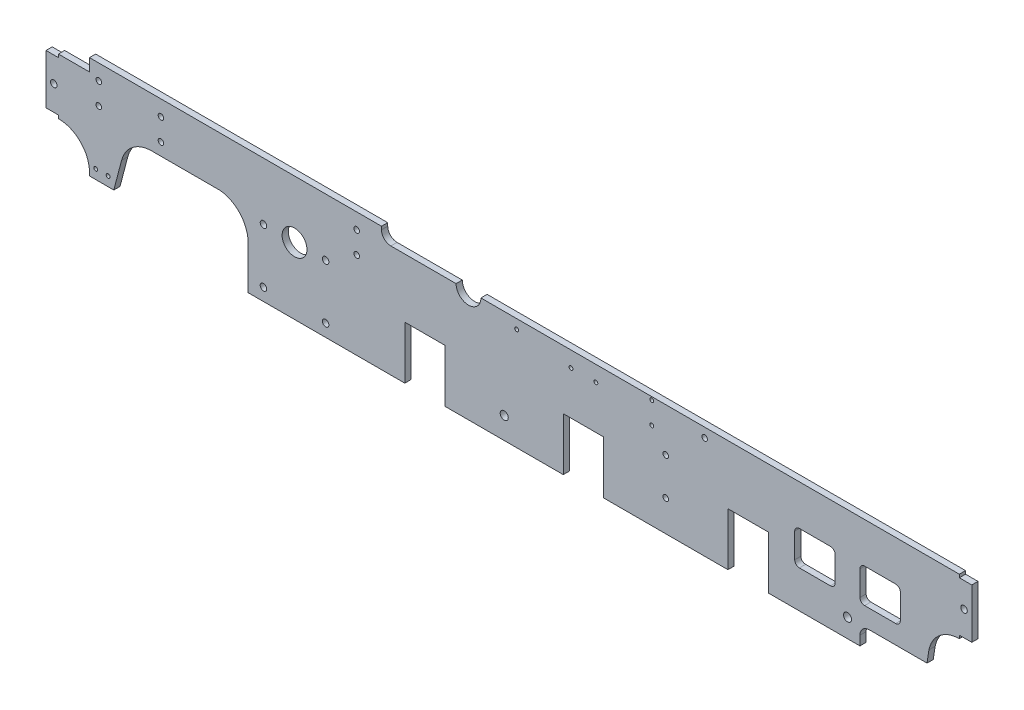
from build123d import *

# Parameters (mm, degrees)
ESQUISSE1_R        = 1.05
ESQUISSE1_R_2      = 1.3
ESQUISSE1_R_3      = 0.625
ESQUISSE1_R_4      = 0.9
ESQUISSE1_R_5      = 4
BOSS_EXTRU_1_DEPTH = 2


with BuildPart() as part:
    # Esquisse1 → Boss.-Extru.1 (new body)
    with BuildSketch(Plane.XY):
        with BuildLine():
            Line((-145, 15), (-149, 15))
            Line((-149, 15), (-149, -1))
            Line((-149, -1), (-145, -1))
            Line((-145, -1), (-145, -2))
            ThreePointArc((-145, -2), (-137.928932188, -4.928932188), (-135, -12))
            Line((-135, -12), (-135, -13))
            Line((-135, -13), (-127.168338795, -13))
            Line((-127.168338795, -13), (-124.67428839, -3.468568753))
            ThreePointArc((-124.67428839, -3.468568753), (-121.110879132, 1.915627343), (-115, 4))
            Line((-115, 4), (-92.916549028, 4))
            ThreePointArc((-92.916549028, 4), (-86.162816659, 0.304952282), (-84, -7.083450972))
            Line((-84, -7.083450972), (-84, -20))
            Line((-84, -20), (-33.5, -20))
            Line((-33.5, -20), (-33.5, -3))
            Line((-33.5, -3), (-20.5, -3))
            Line((-20.5, -3), (-20.5, -20))
            Line((-20.5, -20), (17.5, -20))
            Line((17.5, -20), (17.5, -3))
            Line((17.5, -3), (30.5, -3))
            Line((30.5, -3), (30.5, -20))
            Line((30.5, -20), (70.5, -20))
            Line((70.5, -20), (70.5, -3))
            Line((70.5, -3), (83.5, -3))
            Line((83.5, -3), (83.5, -20))
            Line((83.5, -20), (113, -20))
            Line((113, -20), (113, -17))
            ThreePointArc((113, -17), (113.878679656, -14.878679656), (116, -14))
            Line((116, -14), (134.596227596, -14))
            Line((134.596227596, -14), (135.202041029, -10))
            ThreePointArc((135.202041029, -10), (138.67544468, -4.254033308), (145, -2))
            Line((145, -2), (145, -1))
            Line((145, -1), (149, -1))
            Line((149, -1), (149, 15))
            Line((149, 15), (145, 15))
            Line((145, 15), (145, 16))
            Line((145, 16), (-9.00367652, 16))
            ThreePointArc((-9.00367652, 16), (-13.00367652, 12), (-17.00367652, 16))
            Line((-17.00367652, 16), (-38, 16))
            ThreePointArc((-38, 16), (-40.121320344, 16.878679656), (-41, 19))
            Line((-41, 19), (-41, 20))
            Line((-41, 20), (-135, 20))
            Line((-135, 20), (-135, 16))
            Line((-135, 16), (-145, 16))
            Line((-145, 16), (-145, 15))
        make_face()
        with Locations((-79, -16)):
            Circle(ESQUISSE1_R, mode=Mode.SUBTRACT)
        with Locations((-59, -16)):
            Circle(ESQUISSE1_R, mode=Mode.SUBTRACT)
        with Locations((-1.5, -13)):
            Circle(ESQUISSE1_R_2, mode=Mode.SUBTRACT)
        with Locations((-133, -10)):
            Circle(ESQUISSE1_R_3, mode=Mode.SUBTRACT)
        with Locations((-129, -10)):
            Circle(ESQUISSE1_R_3, mode=Mode.SUBTRACT)
        with Locations((109, -14)):
            Circle(ESQUISSE1_R_2, mode=Mode.SUBTRACT)
        with Locations((50.5, -10)):
            Circle(ESQUISSE1_R_4, mode=Mode.SUBTRACT)
        with BuildLine():
            ThreePointArc((103.5, 3), (104.560660172, 2.560660172), (105, 1.5))
            Line((105, 1.5), (105, -6.5))
            ThreePointArc((105, -6.5), (104.560660172, -7.560660172), (103.5, -8))
            Line((103.5, -8), (93.5, -8))
            ThreePointArc((93.5, -8), (92.439339828, -7.560660172), (92, -6.5))
            Line((92, -6.5), (92, 1.5))
            ThreePointArc((92, 1.5), (92.439339828, 2.560660172), (93.5, 3))
            Line((93.5, 3), (103.5, 3))
        make_face(mode=Mode.SUBTRACT)
        with BuildLine():
            Line((114.5, 3), (124.5, 3))
            ThreePointArc((124.5, 3), (125.560660172, 2.560660172), (126, 1.5))
            Line((126, 1.5), (126, -6.5))
            ThreePointArc((126, -6.5), (125.560660172, -7.560660172), (124.5, -8))
            Line((124.5, -8), (114.5, -8))
            ThreePointArc((114.5, -8), (113.439339828, -7.560660172), (113, -6.5))
            Line((113, -6.5), (113, 1.5))
            ThreePointArc((113, 1.5), (113.439339828, 2.560660172), (114.5, 3))
        make_face(mode=Mode.SUBTRACT)
        with Locations((-79, 1.5)):
            Circle(ESQUISSE1_R, mode=Mode.SUBTRACT)
        with Locations((-146.5, 7)):
            Circle(ESQUISSE1_R, mode=Mode.SUBTRACT)
        with Locations((-132, 8)):
            Circle(ESQUISSE1_R_4, mode=Mode.SUBTRACT)
        with Locations((-112, 8)):
            Circle(ESQUISSE1_R_4, mode=Mode.SUBTRACT)
        with Locations((-69, 1.5)):
            Circle(ESQUISSE1_R_5, mode=Mode.SUBTRACT)
        with Locations((-59, 1.5)):
            Circle(ESQUISSE1_R, mode=Mode.SUBTRACT)
        with Locations((-49, 8)):
            Circle(ESQUISSE1_R_4, mode=Mode.SUBTRACT)
        with Locations((-132, 15)):
            Circle(ESQUISSE1_R_4, mode=Mode.SUBTRACT)
        with Locations((-112, 15)):
            Circle(ESQUISSE1_R_4, mode=Mode.SUBTRACT)
        with Locations((-49, 15)):
            Circle(ESQUISSE1_R_4, mode=Mode.SUBTRACT)
        with Locations((50.5, 2)):
            Circle(ESQUISSE1_R_4, mode=Mode.SUBTRACT)
        with Locations((46, 8)):
            Circle(ESQUISSE1_R_3, mode=Mode.SUBTRACT)
        with Locations((146.5, 7)):
            Circle(ESQUISSE1_R, mode=Mode.SUBTRACT)
        with Locations((20, 11)):
            Circle(ESQUISSE1_R_3, mode=Mode.SUBTRACT)
        with Locations((28, 11)):
            Circle(ESQUISSE1_R_3, mode=Mode.SUBTRACT)
        with Locations((2.5, 13)):
            Circle(ESQUISSE1_R_3, mode=Mode.SUBTRACT)
        with Locations((63, 13)):
            Circle(ESQUISSE1_R_4, mode=Mode.SUBTRACT)
        with Locations((46, 15)):
            Circle(ESQUISSE1_R_3, mode=Mode.SUBTRACT)
    extrude(amount=BOSS_EXTRU_1_DEPTH)


solid = part.part
